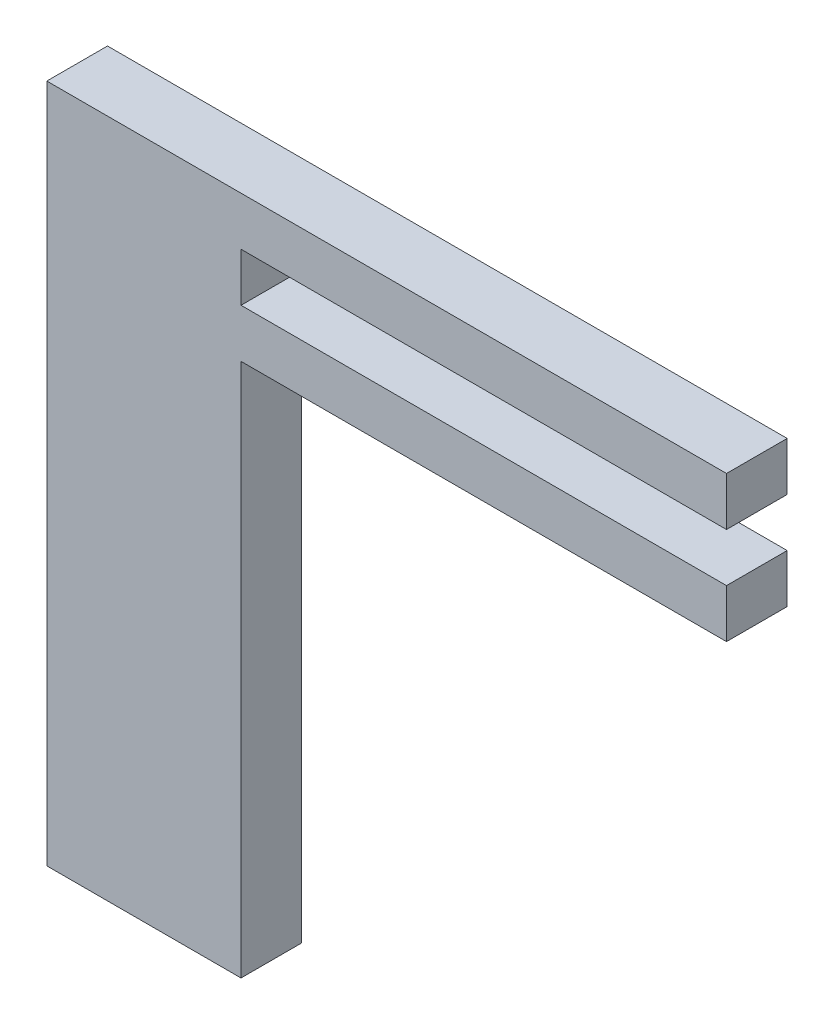
from build123d import *

# Parameters (mm, degrees)
ESBO_O2_W                = 8
ESBO_O2_H                = 28
RESSALTO_EXTRUS_O1_DEPTH = 2.5
ESBO_O3_W                = 3
ESBO_O3_H                = 0.6
CORTE_EXTRUS_O1_DEPTH    = 25
ESBO_O4_W                = 2.5
ESBO_O4_H                = 2
RESSALTO_EXTRUS_O2_DEPTH = 20


with BuildPart() as part:
    # Esboço2 → Ressalto-extrusão1 (new body)
    with BuildSketch(Plane.XY):
        Rectangle(ESBO_O2_W, ESBO_O2_H)
    extrude(amount=RESSALTO_EXTRUS_O1_DEPTH)

    # Esboço3 → Corte-extrusão1 (cut)
    with BuildSketch(Plane.XZ.offset(14)):
        with Locations((0, 1.25)):
            Rectangle(ESBO_O3_W, ESBO_O3_H)
    extrude(amount=-CORTE_EXTRUS_O1_DEPTH, mode=Mode.SUBTRACT)

    # Esboço4 → Ressalto-extrusão2 (add)
    with BuildSketch(Plane(origin=(4, 0, 0), x_dir=(0, 0, -1), z_dir=(1, 0, 0))):
        with Locations((-1.25, 13)):
            Rectangle(ESBO_O4_W, ESBO_O4_H)
        with Locations((-1.25, 9)):
            Rectangle(ESBO_O4_W, ESBO_O4_H)
    extrude(amount=RESSALTO_EXTRUS_O2_DEPTH)


solid = part.part
